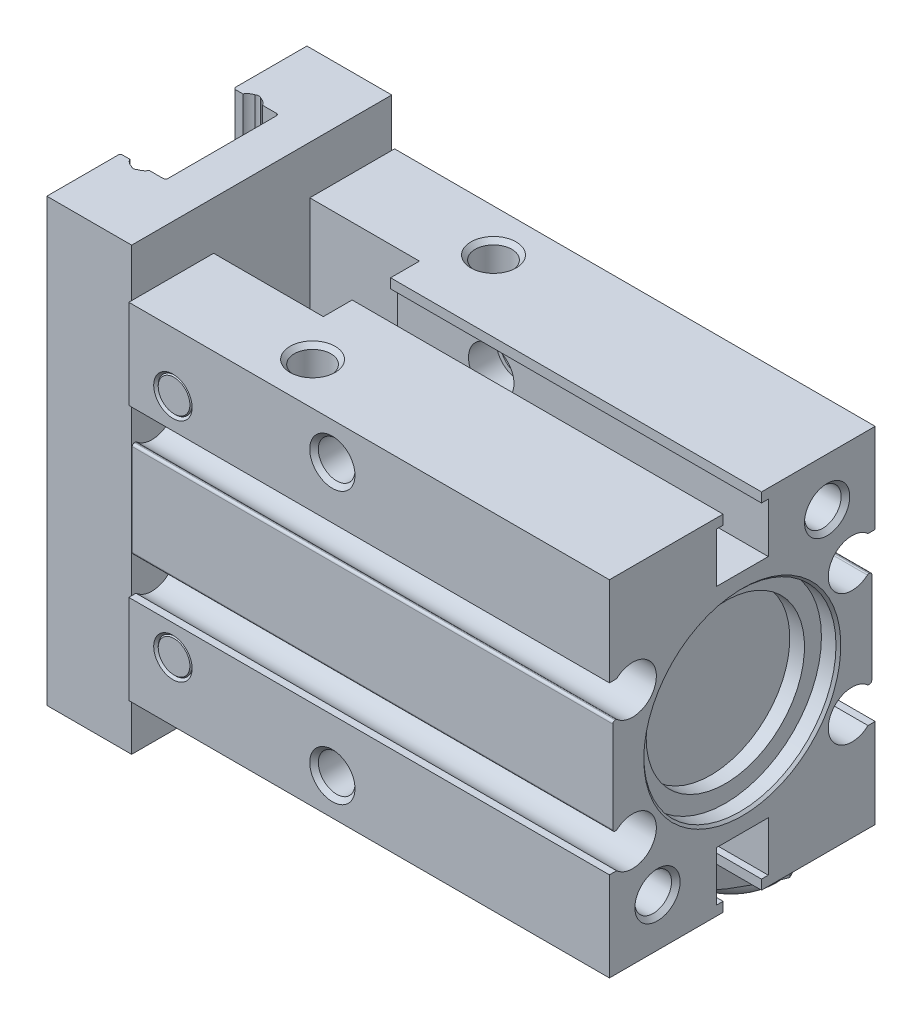
from build123d import *

# Parameters (mm, degrees)
BOSS_EXTRUDE1_DEPTH     = 42.5
CUT_EXTRUDE1_DEPTH      = 15.25
CUT_EXTRUDE1_DEPTH_BACK = 15.25
SKETCH2_W               = 9.7
SKETCH2_H               = 8.5
SKETCH5_W               = 23
SKETCH5_H               = 39
BOSS_EXTRUDE2_DEPTH     = 7.5
CUT_EXTRUDE2_DEPTH      = 19.5
CUT_EXTRUDE2_DEPTH_BACK = 19.5
SKETCH19_R              = 7
CUT_EXTRUDE3_DEPTH      = 4
SCALE_3_SCALE           = 2.5


with BuildPart() as part:
    # Sketch1 → Boss-Extrude1 (new body)
    with BuildSketch(Plane(origin=(0, 0, 0), x_dir=(0, 0, -1), z_dir=(1, 0, 0))):
        with BuildLine():
            Line((-11.75, 7.35), (-11.116862732, 7.35))
            ThreePointArc((-11.116862732, 7.35), (-7.600310792, 5.836127953), (-11.062700186, 4.202173913))
            ThreePointArc((-11.062700186, 4.202173913), (-11.123324748, 4.237662973), (-11.192481156, 4.25))
            Line((-11.192481156, 4.25), (-11.25, 4.25))
            ThreePointArc((-11.25, 4.25), (-11.391421356, 4.191421356), (-11.45, 4.05))
            Line((-11.45, 4.05), (-11.45, -4.05))
            ThreePointArc((-11.45, -4.05), (-11.391421356, -4.191421356), (-11.25, -4.25))
            Line((-11.25, -4.25), (-11.192481156, -4.25))
            ThreePointArc((-11.192481156, -4.25), (-11.123324748, -4.237662973), (-11.062700186, -4.202173913))
            ThreePointArc((-11.062700186, -4.202173913), (-7.600310792, -5.836127953), (-11.116862732, -7.35))
            Line((-11.116862732, -7.35), (-11.75, -7.35))
            Line((-11.75, -7.35), (-11.75, -15.25))
            Line((-11.75, -15.25), (-1.7, -15.25))
            Line((-1.7, -15.25), (-1.7, -14.4))
            Line((-1.7, -14.4), (-2.3, -14.4))
            Line((-2.3, -14.4), (-2.3, -10))
            Line((-2.3, -10), (2.3, -10))
            Line((2.3, -10), (2.3, -14.4))
            Line((2.3, -14.4), (1.7, -14.4))
            Line((1.7, -14.4), (1.7, -15.25))
            Line((1.7, -15.25), (11.75, -15.25))
            Line((11.75, -15.25), (11.75, -7.35))
            Line((11.75, -7.35), (11.116862732, -7.35))
            ThreePointArc((11.116862732, -7.35), (7.600310792, -5.836127953), (11.062700186, -4.202173913))
            ThreePointArc((11.062700186, -4.202173913), (11.123324748, -4.237662973), (11.192481156, -4.25))
            Line((11.192481156, -4.25), (11.25, -4.25))
            ThreePointArc((11.25, -4.25), (11.391421356, -4.191421356), (11.45, -4.05))
            Line((11.45, -4.05), (11.45, 4.05))
            ThreePointArc((11.45, 4.05), (11.391421356, 4.191421356), (11.25, 4.25))
            Line((11.25, 4.25), (11.192481156, 4.25))
            ThreePointArc((11.192481156, 4.25), (11.123324748, 4.237662973), (11.062700186, 4.202173913))
            ThreePointArc((11.062700186, 4.202173913), (7.600310792, 5.836127953), (11.116862732, 7.35))
            Line((11.116862732, 7.35), (11.75, 7.35))
            Line((11.75, 7.35), (11.75, 15.25))
            Line((11.75, 15.25), (1.7, 15.25))
            Line((1.7, 15.25), (1.7, 14.4))
            Line((1.7, 14.4), (2.3, 14.4))
            Line((2.3, 14.4), (2.3, 10))
            Line((2.3, 10), (-2.3, 10))
            Line((-2.3, 10), (-2.3, 14.4))
            Line((-2.3, 14.4), (-1.7, 14.4))
            Line((-1.7, 14.4), (-1.7, 15.25))
            Line((-1.7, 15.25), (-11.75, 15.25))
            Line((-11.75, 15.25), (-11.75, 7.35))
        make_face()
    extrude(amount=-BOSS_EXTRUDE1_DEPTH)

    # Sketch2 → Cut-Extrude1 (cut, two sides: drawn at the far end of the back side and taken through both)
    with BuildSketch(Plane(origin=(0, 0, 0), x_dir=(1, 0, 0), z_dir=(0, 1, 0)).offset(-CUT_EXTRUDE1_DEPTH_BACK)):
        with Locations((-37.65, 0)):
            Rectangle(SKETCH2_W, SKETCH2_H)
    extrude(amount=CUT_EXTRUDE1_DEPTH + CUT_EXTRUDE1_DEPTH_BACK, mode=Mode.SUBTRACT)

    # Sketch3 → Cut-Revolve1 (revolve, cut)
    with BuildSketch(Plane(origin=(-24.5, 0, 0), x_dir=(0, 0, -1), z_dir=(1, 0, 0))):
        Polygon((-11.75, 12), (-11.75, 14), (-11.371, 13.621), (-4.75, 13.621), (-4.75, 14.01), (4.75, 14.01), (4.75, 13.621), (11.371, 13.621), (11.75, 14), (11.75, 12), align=None)
    revolve(axis=Axis((-24.5, 12, -11.75), (0, 0, 1)), mode=Mode.SUBTRACT)

    # Sketch4 → Cut-Revolve2 (revolve, cut)
    with BuildSketch(Plane(origin=(-24.5, 0, 0), x_dir=(0, 0, -1), z_dir=(1, 0, 0))):
        Polygon((-11.75, -12), (-11.75, -10), (-11.371, -10.379), (-4.75, -10.379), (-4.75, -9.99), (4.75, -9.99), (4.75, -10.379), (11.371, -10.379), (11.75, -10), (11.75, -12), align=None)
    revolve(axis=Axis((-24.5, -12, -11.75), (0, 0, 1)), mode=Mode.SUBTRACT)

    # Sketch5 → Boss-Extrude2 (add)
    with BuildSketch(Plane(origin=(-42.5, 0, 0), x_dir=(0, 0, -1), z_dir=(1, 0, 0))):
        Rectangle(SKETCH5_W, SKETCH5_H)
    extrude(amount=-BOSS_EXTRUDE2_DEPTH)

    # Sketch6 → Cut-Extrude2 (cut, two sides: drawn at the far end of the back side and taken through both)
    with BuildSketch(Plane(origin=(0, 0, 0), x_dir=(1, 0, 0), z_dir=(0, 1, 0)).offset(-CUT_EXTRUDE2_DEPTH_BACK)):
        with BuildLine():
            Line((-50, 5.141421356), (-50, -5.141421356))
            Line((-50, -5.141421356), (-49.858578644, -5))
            Line((-49.858578644, -5), (-49.166025404, -5))
            ThreePointArc((-49.166025404, -5), (-48.908088072, -5.293869571), (-48.557179553, -5.466363636))
            ThreePointArc((-48.557179553, -5.466363636), (-48.3, -5.56), (-48.042820447, -5.466363636))
            ThreePointArc((-48.042820447, -5.466363636), (-47.691911928, -5.293869571), (-47.433974596, -5))
            Line((-47.433974596, -5), (-46.2, -5))
            ThreePointArc((-46.2, -5), (-46.058578644, -4.941421356), (-46, -4.8))
            Line((-46, -4.8), (-46, 4.8))
            ThreePointArc((-46, 4.8), (-46.058578644, 4.941421356), (-46.2, 5))
            Line((-46.2, 5), (-47.433974596, 5))
            ThreePointArc((-47.433974596, 5), (-47.691911928, 5.293869571), (-48.042820447, 5.466363636))
            ThreePointArc((-48.042820447, 5.466363636), (-48.3, 5.56), (-48.557179553, 5.466363636))
            ThreePointArc((-48.557179553, 5.466363636), (-48.908088072, 5.293869571), (-49.166025404, 5))
            Line((-49.166025404, 5), (-49.858578644, 5))
            Line((-49.858578644, 5), (-50, 5.141421356))
        make_face()
    extrude(amount=CUT_EXTRUDE2_DEPTH + CUT_EXTRUDE2_DEPTH_BACK, mode=Mode.SUBTRACT)

    # Sketch7 → Cut-Revolve3 (revolve, cut)
    with BuildSketch(Plane(origin=(-38.6, 0, 0), x_dir=(0, 0, -1), z_dir=(1, 0, 0))):
        Polygon((11.65, 10), (11.65, 11.4), (11.55, 11.5), (11.75, 11.7), (11.75, 10), align=None)
    revolve(axis=Axis((-38.6, 10, -11.75), (0, 0, 1)), mode=Mode.SUBTRACT)

    # Sketch8 → Cut-Revolve4 (revolve, cut)
    with BuildSketch(Plane(origin=(-38.6, 0, 0), x_dir=(0, 0, -1), z_dir=(1, 0, 0))):
        Polygon((-11.75, 10), (-11.75, 11.7), (-11.55, 11.5), (-11.65, 11.4), (-11.65, 10), align=None)
    revolve(axis=Axis((-38.6, 10, 11.65), (0, 0, 1)), mode=Mode.SUBTRACT)

    # Sketch9 → Cut-Revolve5 (revolve, cut)
    with BuildSketch(Plane(origin=(-38.6, 0, 0), x_dir=(0, 0, -1), z_dir=(1, 0, 0))):
        Polygon((11.65, -10), (11.65, -8.6), (11.55, -8.5), (11.75, -8.3), (11.75, -10), align=None)
    revolve(axis=Axis((-38.6, -10, -11.75), (0, 0, 1)), mode=Mode.SUBTRACT)

    # Sketch10 → Cut-Revolve6 (revolve, cut)
    with BuildSketch(Plane(origin=(-38.6, 0, 0), x_dir=(0, 0, -1), z_dir=(1, 0, 0))):
        Polygon((-11.75, -10), (-11.75, -8.3), (-11.55, -8.5), (-11.65, -8.6), (-11.65, -10), align=None)
    revolve(axis=Axis((-38.6, -10, 11.65), (0, 0, 1)), mode=Mode.SUBTRACT)

    # Sketch11 → Cut-Revolve7 (revolve, cut)
    with BuildSketch(Plane.XY.offset(6.5)):
        Polygon((-19, -8.25), (-18.75, -8.25), (-18.75, -10.25), (-16.933, -10.25), (-16.933, -14.817), (-16.5, -15.25), (-19, -15.25), align=None)
    revolve(axis=Axis((-19, -15.25, 6.5), (0, 1, 0)), mode=Mode.SUBTRACT)

    # Sketch12 → Cut-Revolve8 (revolve, cut)
    with BuildSketch(Plane.XY.offset(-6.5)):
        Polygon((-7.5, -8.25), (-7.25, -8.25), (-7.25, -10.25), (-5.433, -10.25), (-5.433, -14.817), (-5, -15.25), (-7.5, -15.25), align=None)
    revolve(axis=Axis((-7.5, -15.25, -6.5), (0, 1, 0)), mode=Mode.SUBTRACT)

    # Sketch13 → Cut-Revolve9 (revolve, cut)
    with BuildSketch(Plane(origin=(-30, 0, 0), x_dir=(0, 0, -1), z_dir=(1, 0, 0))):
        Polygon((-8, 9.75), (-8.754974596, 9.75), (-9.621, 10.25), (-9.621, 14.871), (-10, 15.25), (-8, 15.25), align=None)
    revolve(axis=Axis((-30, 15.25, 8), (0, -1, 0)), mode=Mode.SUBTRACT)

    # Sketch14 → Cut-Revolve10 (revolve, cut)
    with BuildSketch(Plane(origin=(-30, 0, 0), x_dir=(0, 0, -1), z_dir=(1, 0, 0))):
        Polygon((8, 9.75), (7.245025404, 9.75), (6.379, 10.25), (6.379, 14.871), (6, 15.25), (8, 15.25), align=None)
    revolve(axis=Axis((-30, 15.25, -8), (0, -1, 0)), mode=Mode.SUBTRACT)

    # Sketch15 → Cut-Revolve11 (revolve, cut)
    with BuildSketch(Plane.XY):
        Polygon((-2.8, 0), (-2.8, 7), (-1.5, 7), (-1.5, 8.5), (-0.212132034, 8.5), (0, 8.712132034), (0, 0), align=None)
    revolve(axis=Axis((0, 0, 0), (-1, 0, 0)), mode=Mode.SUBTRACT)

    # Sketch16 → Cut-Revolve12 (revolve, cut)
    with BuildSketch(Plane.XY.offset(7.5)):
        Polygon((-9, -11), (-9, -10.245025404), (-8.5, -9.379), (-0.379, -9.379), (0, -9), (0, -11), align=None)
    revolve(axis=Axis((0, -11, 7.5), (-1, 0, 0)), mode=Mode.SUBTRACT)

    # Sketch17 → Cut-Revolve13 (revolve, cut)
    with BuildSketch(Plane.XY.offset(-7.5)):
        Polygon((-9, 11), (-9, 11.754974596), (-8.5, 12.621), (-0.379, 12.621), (0, 13), (0, 11), align=None)
    revolve(axis=Axis((0, 11, -7.5), (-1, 0, 0)), mode=Mode.SUBTRACT)

    # Sketch18 → Revolve1 (revolve)
    with BuildSketch(Plane.XY.offset(-6.5)):
        with BuildLine():
            Line((-7.5, -15.25), (-2.3, -15.25))
            Line((-2.3, -15.25), (-2.3, -17.83))
            Line((-2.3, -17.83), (-2.75, -17.95))
            Line((-2.75, -17.95), (-3.15, -17.95))
            ThreePointArc((-3.15, -17.95), (-3.530761184, -18.869238816), (-4.45, -19.25))
            Line((-4.45, -19.25), (-4.45, -18.65))
            Line((-4.45, -18.65), (-7.5, -18.65))
            Line((-7.5, -18.65), (-7.5, -15.25))
        make_face()
    revolve(axis=Axis((-7.5, -18.65, -6.5), (0, 1, 0)))

    # Sketch19 → Cut-Extrude3 (cut)
    with BuildSketch(Plane(origin=(0, -15.25, 0), x_dir=(1, 0, 0), z_dir=(0, 1, 0))):
        with Locations((-7.5, 6.5)):
            Circle(SKETCH19_R)
        Polygon((-12.7, 6.5), (-10.1, 1.9966679), (-4.9, 1.9966679), (-2.3, 6.5), (-4.9, 11.0033321), (-10.1, 11.0033321), align=None, mode=Mode.SUBTRACT)
    extrude(amount=-CUT_EXTRUDE3_DEPTH, mode=Mode.SUBTRACT)


with BuildPart() as part_1:
    # 缩放比例3: scaled about (-24.852009735, -0.123574231, -0.056029227)
    add(part.part.scale(SCALE_3_SCALE).moved(Location((37.278014603, 0.185361347, 0.08404384))))


solid = part_1.part
